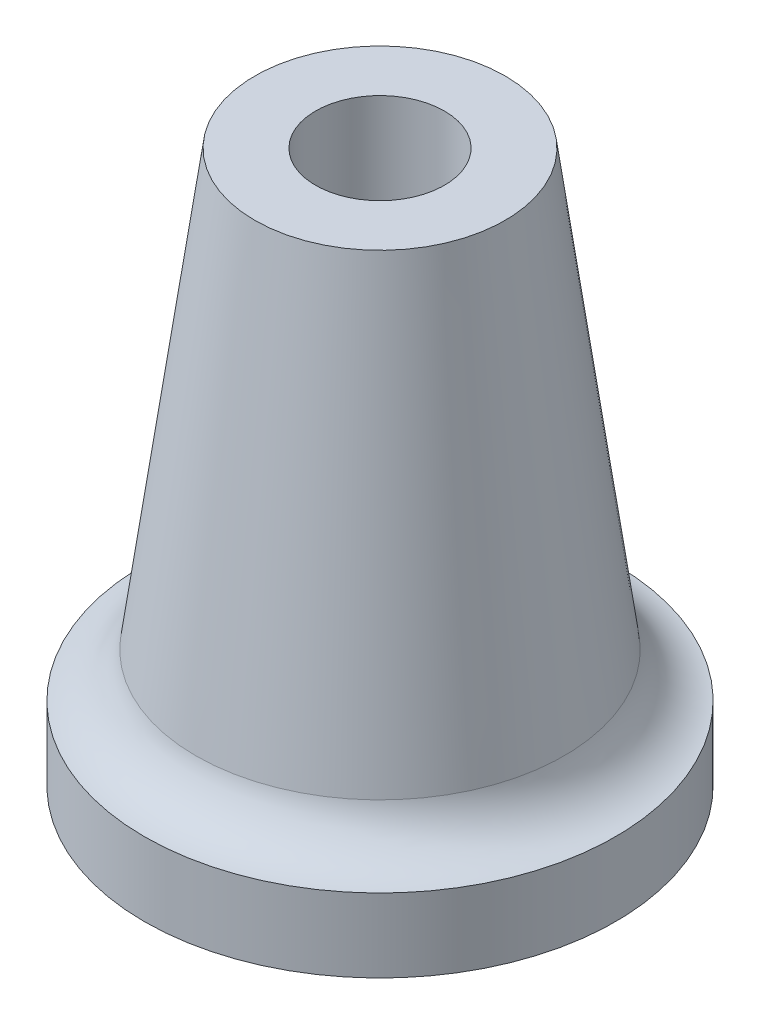
from build123d import *


with BuildPart() as part:
    # Esquisse1 → Révolution1 (revolve)
    with BuildSketch(Plane.XY, mode=Mode.PRIVATE) as r_volution1_sk:
        Polygon((115, 80.978839747), (250, 80.978839747), (170, 670.978839747), (87.5, 670.978839747), (87.5, 290.978839747), (115, 290.978839747), align=None)
        with BuildLine():
            Line((115, 20.978839747), (320, 20.978839747))
            ThreePointArc((320, 20.978839747), (275.487697577, 39.881153587), (250, 80.978839747))
            Line((250, 80.978839747), (115, 80.978839747))
            Line((115, 80.978839747), (115, 20.978839747))
        make_face()
        Polygon((180, -39.021160253), (180, -79.021160253), (320, -79.021160253), (320, 20.978839747), (115, 20.978839747), (115, -39.021160253), align=None)
    revolve(r_volution1_sk.sketch.rotate(Axis((0, -112.379494544, 0), (0, 1, 0)), 90), axis=Axis((0, -112.379494544, 0), (0, 1, 0)))


solid = part.part
